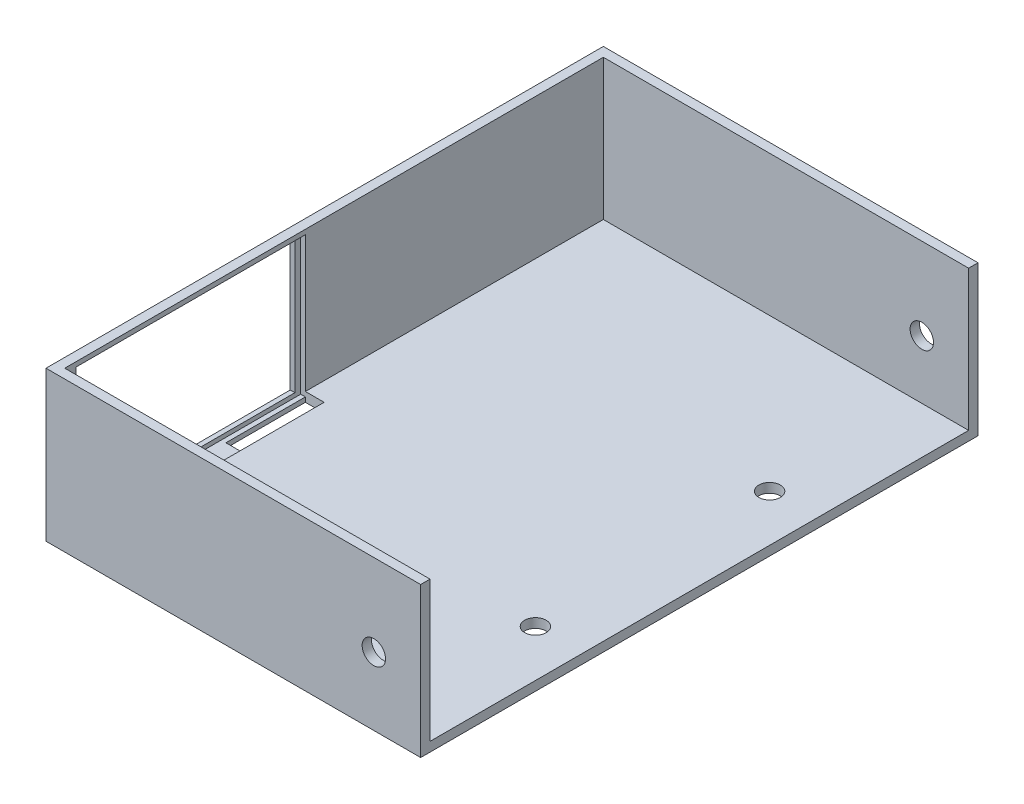
from build123d import *

# Parameters (mm, degrees)
SKETCH1_W               = 80
SKETCH1_H               = 119
BOSS_EXTRUDE1_DEPTH     = 32
SKETCH2_W               = 78
SKETCH2_H               = 115
CUT_EXTRUDE1_DEPTH      = 30
CUT_EXTRUDE2_DEPTH      = 130.55693729
CUT_EXTRUDE2_DEPTH_BACK = 130.55693729
SKETCH3_R               = 2.5
SKETCH4_W               = 47.7
SKETCH4_H               = 28.2
CUT_EXTRUDE4_DEPTH      = 10
CUT_EXTRUDE5_START      = -1
SKETCH5_W               = 5
SKETCH5_H               = 48.939685833
CUT_EXTRUDE5_DEPTH      = 30
SKETCH6_W               = 4
SKETCH6_H               = 16.969842916
SKETCH6_H_2             = 16.969842917
CUT_EXTRUDE6_DEPTH      = 2
SKETCH7_R               = 2.3
CUT_EXTRUDE7_DEPTH      = 79.51273782


with BuildPart() as part:
    # Sketch1 → Boss-Extrude1 (new body)
    with BuildSketch(Plane(origin=(0, 0, 0), x_dir=(1, 0, 0), z_dir=(0, 1, 0))):
        Rectangle(SKETCH1_W, SKETCH1_H)
    extrude(amount=BOSS_EXTRUDE1_DEPTH)

    # Sketch2 → Cut-Extrude1 (cut)
    with BuildSketch(Plane(origin=(0, 32, 0), x_dir=(1, 0, 0), z_dir=(0, 1, 0))):
        with Locations((1, 0)):
            Rectangle(SKETCH2_W, SKETCH2_H)
    extrude(amount=-CUT_EXTRUDE1_DEPTH, mode=Mode.SUBTRACT)

    # Sketch3 → Cut-Extrude2 (cut, two sides: drawn at the far end of the back side and taken through both)
    with BuildSketch(Plane.XY.offset(59.5).offset(-CUT_EXTRUDE2_DEPTH_BACK)):
        with Locations((30, 14.5)):
            Circle(SKETCH3_R)
    extrude(amount=CUT_EXTRUDE2_DEPTH + CUT_EXTRUDE2_DEPTH_BACK, mode=Mode.SUBTRACT)

    # Sketch4 → Cut-Extrude4 (cut)
    with BuildSketch(Plane(origin=(-38, 0, 0), x_dir=(0, 0, -1), z_dir=(1, 0, 0))):
        with Locations((-31.205661858, 16)):
            Rectangle(SKETCH4_W, SKETCH4_H)
    extrude(amount=-CUT_EXTRUDE4_DEPTH, mode=Mode.SUBTRACT)

    # Sketch5 → Cut-Extrude5 (cut)
    with BuildSketch(Plane(origin=(0, 2, 0), x_dir=(1, 0, 0), z_dir=(0, 1, 0)).offset(CUT_EXTRUDE5_START)):
        with Locations((-36.5, -30.585818942)):
            Rectangle(SKETCH5_W, SKETCH5_H)
    extrude(amount=CUT_EXTRUDE5_DEPTH, mode=Mode.SUBTRACT)

    # Sketch6 → Cut-Extrude6 (cut)
    with BuildSketch(Plane(origin=(0, 1, 0), x_dir=(1, 0, 0), z_dir=(0, 1, 0))):
        with Locations((-36, -14.600897483)):
            Rectangle(SKETCH6_W, SKETCH6_H)
        with Locations((-36, -46.570740399)):
            Rectangle(SKETCH6_W, SKETCH6_H_2)
    extrude(amount=-CUT_EXTRUDE6_DEPTH, mode=Mode.SUBTRACT)

    # Sketch7 → Cut-Extrude7 (cut, through all)
    with BuildSketch(Plane.XZ):
        with Locations(Location((30, 25, 0), (0, 0, 270))):
            Circle(SKETCH7_R)
        with Locations(Location((30, -25, 0), (0, 0, 270))):
            Circle(SKETCH7_R)
    extrude(amount=-CUT_EXTRUDE7_DEPTH, mode=Mode.SUBTRACT)


solid = part.part
